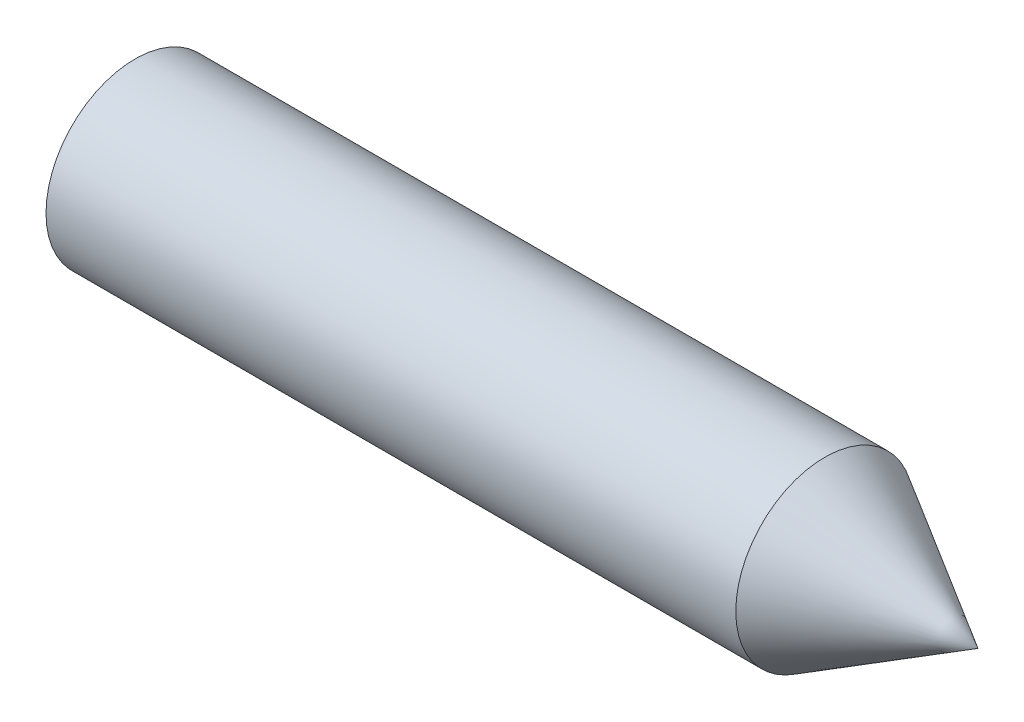
from build123d import *


with BuildPart() as part:
    # Sketch1 → Revolve1 (revolve)
    with BuildSketch(Plane.XY, mode=Mode.PRIVATE) as revolve1_sk:
        Polygon((31.242, 0), (25.566317645, 3.302), (0, 3.302), (0, 0), align=None)
    revolve(revolve1_sk.sketch.rotate(Axis((0, 0, 0), (1, 0, 0)), 90), axis=Axis((0, 0, 0), (1, 0, 0)))


solid = part.part
